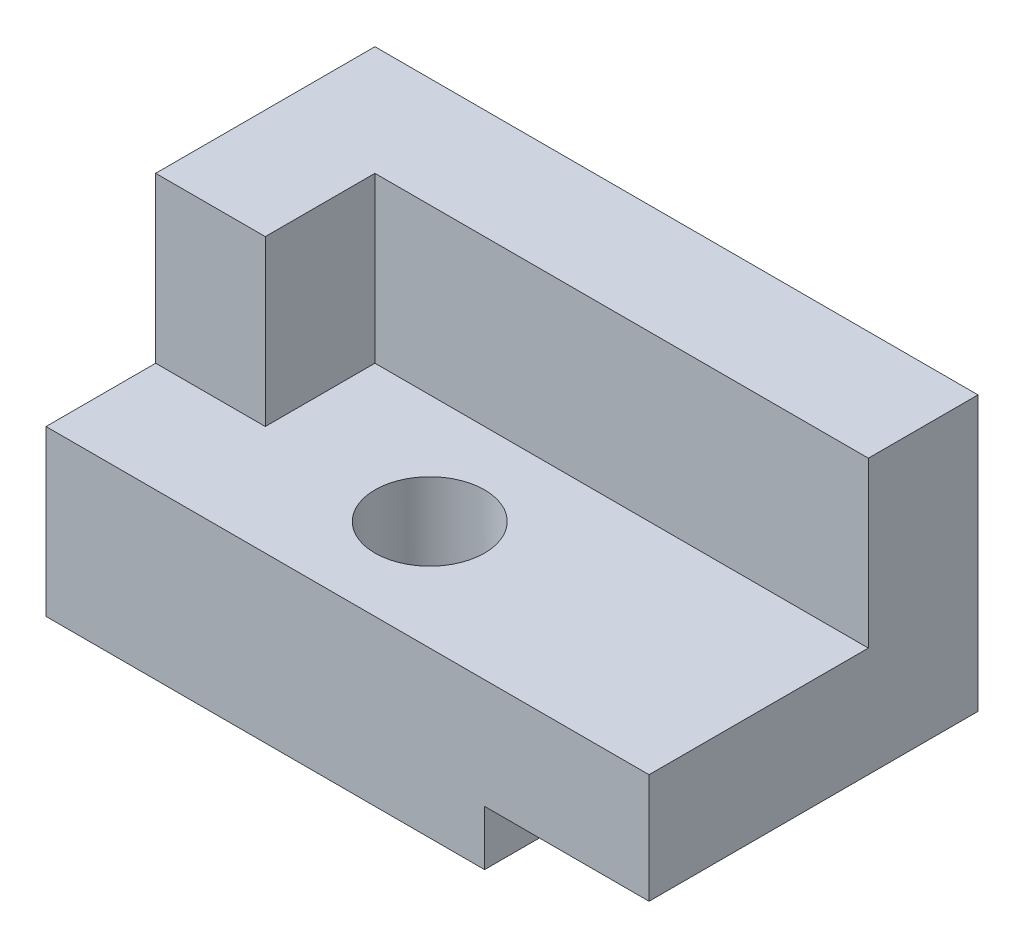
from build123d import *

# Parameters (mm, degrees)
BOSS_EXTRUDE1_START     = -12.7
BOSS_EXTRUDE1_DEPTH     = 76.2
BOSS_EXTRUDE2_START     = -50.8
BOSS_EXTRUDE2_DEPTH     = 38.1
SKETCH7_R               = 12.7
CUT_EXTRUDE1_DEPTH      = 257.841604885
CUT_EXTRUDE2_DEPTH      = 262.509005581
CUT_EXTRUDE2_DEPTH_BACK = 262.509005581


with BuildPart() as part:
    # Sketch5 → Boss-Extrude1 (new body)
    with BuildSketch(Plane(origin=(0, 114.3, 0), x_dir=(-1, 0, 0), z_dir=(0, 1, 0)).offset(BOSS_EXTRUDE1_START)):
        Polygon((-88.9, -25.4), (-88.9, -76.2), (-228.6, -76.2), (-228.6, -50.8), (-114.3, -50.8), (-114.3, -25.4), align=None)
    extrude(amount=-BOSS_EXTRUDE1_DEPTH)

    # Sketch6 → Boss-Extrude2 (add)
    with BuildSketch(Plane(origin=(0, 114.3, 0), x_dir=(-1, 0, 0), z_dir=(0, 1, 0)).offset(BOSS_EXTRUDE2_START)):
        Polygon((-228.6, 0), (-88.9, 0), (-88.9, -25.4), (-114.3, -25.4), (-114.3, -50.8), (-228.6, -50.8), align=None)
    extrude(amount=-BOSS_EXTRUDE2_DEPTH)

    # Sketch7 → Cut-Extrude1 (cut, through all)
    with BuildSketch(Plane(origin=(0, 114.3, 0), x_dir=(-1, 0, 0), z_dir=(0, 1, 0))):
        with Locations(Location((-152.4, -25.4, 0), (0, 0, 90))):
            Circle(SKETCH7_R)
    extrude(amount=-CUT_EXTRUDE1_DEPTH, mode=Mode.SUBTRACT)

    # Sketch8 → Cut-Extrude2 (cut, two sides: drawn at the far end of the back side and taken through both)
    with BuildSketch(Plane.XY.offset(-CUT_EXTRUDE2_DEPTH_BACK)):
        Polygon((545.509367729, 38.1), (228.6, 38.1), (190.5, 38.1), (190.5, 25.4), (190.5, -291.509367729), (621.753014004, -755.995134283), (976.762381733, -426.385766553), align=None)
    extrude(amount=CUT_EXTRUDE2_DEPTH + CUT_EXTRUDE2_DEPTH_BACK, mode=Mode.SUBTRACT)


solid = part.part
